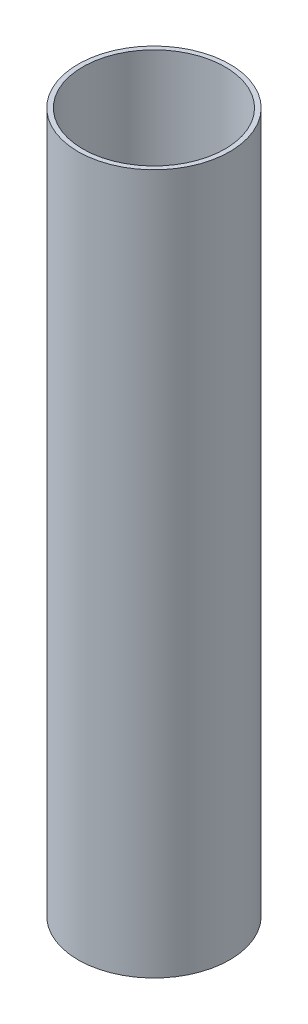
from build123d import *

# Parameters (mm, degrees)
SKETCH1_R           = 32.5
SKETCH1_R_2         = 30.5
BOSS_EXTRUDE1_DEPTH = 300


with BuildPart() as part:
    # Sketch1 → Boss-Extrude1 (new body)
    with BuildSketch(Plane(origin=(0, 0, 0), x_dir=(1, 0, 0), z_dir=(0, 1, 0))):
        with Locations(Location((0, 0, 0), (0, 0, 270))):
            Circle(SKETCH1_R)
        with Locations(Location((0, 0, 0), (0, 0, 270))):
            Circle(SKETCH1_R_2, mode=Mode.SUBTRACT)
    extrude(amount=BOSS_EXTRUDE1_DEPTH)


solid = part.part
